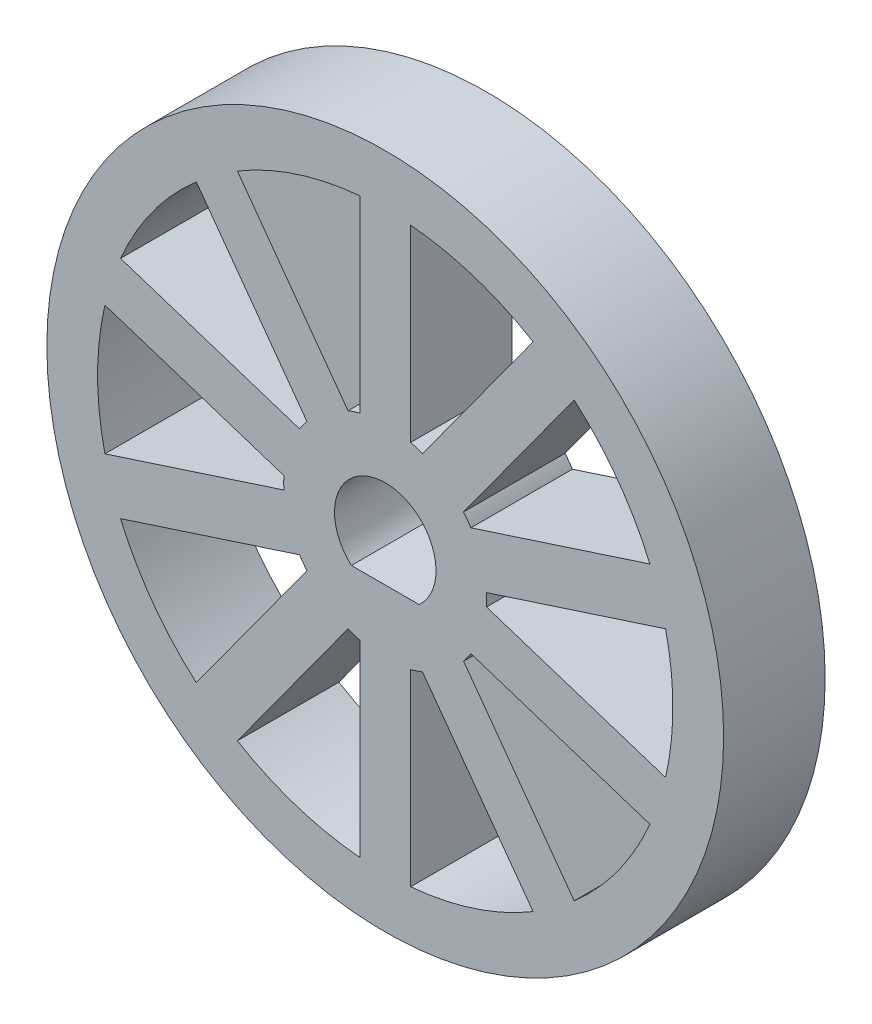
from build123d import *

# Parameters (mm, degrees)
SKETCH1_R           = 20
BOSS_EXTRUDE1_DEPTH = 6


with BuildPart() as part:
    # Sketch1 → Boss-Extrude1 (new body)
    with BuildSketch(Plane.XY):
        Circle(SKETCH1_R)
        with BuildLine():
            Line((-2, -2.236067977), (2, -2.236067977))
            ThreePointArc((2, -2.236067977), (0, 3), (-2, -2.236067977))
        make_face(mode=Mode.SUBTRACT)
        with BuildLine():
            Line((-16.568425726, -3.806214518), (-5.988664565, -0.368641735))
            ThreePointArc((-5.988664565, -0.368641735), (-6, 0), (-5.988664565, 0.368641735))
            Line((-5.988664565, 0.368641735), (-16.568425726, 3.806214518))
            ThreePointArc((-16.568425726, 3.806214518), (-17, 0), (-16.568425726, -3.806214518))
        make_face(mode=Mode.SUBTRACT)
        with BuildLine():
            Line((-1.5, -16.933694222), (-1.5, -5.809475019))
            ThreePointArc((-1.5, -5.809475019), (-1.854101966, -5.706339098), (-2.201198248, -5.581641897))
            Line((-2.201198248, -5.581641897), (-8.739850239, -14.581324281))
            ThreePointArc((-8.739850239, -14.581324281), (-5.253288904, -16.167960777), (-1.5, -16.933694222))
        make_face(mode=Mode.SUBTRACT)
        with BuildLine():
            Line((1.5, -16.933694222), (1.5, -5.809475019))
            ThreePointArc((1.5, -5.809475019), (1.854101966, -5.706339098), (2.201198248, -5.581641897))
            Line((2.201198248, -5.581641897), (8.739850239, -14.581324281))
            ThreePointArc((8.739850239, -14.581324281), (5.253288904, -16.167960777), (1.5, -16.933694222))
        make_face(mode=Mode.SUBTRACT)
        with BuildLine():
            Line((-1.5, 5.809475019), (-1.5, 16.933694222))
            ThreePointArc((-1.5, 16.933694222), (-5.253288904, 16.167960777), (-8.739850239, 14.581324281))
            Line((-8.739850239, 14.581324281), (-2.201198248, 5.581641897))
            ThreePointArc((-2.201198248, 5.581641897), (-1.854101966, 5.706339098), (-1.5, 5.809475019))
        make_face(mode=Mode.SUBTRACT)
        with BuildLine():
            Line((-5.061613582, 3.221811284), (-15.641374743, 6.659384067))
            ThreePointArc((-15.641374743, 6.659384067), (-13.753288904, 9.992349289), (-11.166901222, 12.817968525))
            Line((-11.166901222, 12.817968525), (-4.628249231, 3.818286141))
            ThreePointArc((-4.628249231, 3.818286141), (-4.854101966, 3.526711514), (-5.061613582, 3.221811284))
        make_face(mode=Mode.SUBTRACT)
        with BuildLine():
            Line((-15.641374743, -6.659384067), (-5.061613582, -3.221811284))
            ThreePointArc((-5.061613582, -3.221811284), (-4.854101966, -3.526711514), (-4.628249231, -3.818286141))
            Line((-4.628249231, -3.818286141), (-11.166901222, -12.817968525))
            ThreePointArc((-11.166901222, -12.817968525), (-13.753288904, -9.992349289), (-15.641374743, -6.659384067))
        make_face(mode=Mode.SUBTRACT)
        with BuildLine():
            Line((11.166901222, 12.817968525), (4.628249231, 3.818286141))
            ThreePointArc((4.628249231, 3.818286141), (4.854101966, 3.526711514), (5.061613582, 3.221811284))
            Line((5.061613582, 3.221811284), (15.641374743, 6.659384067))
            ThreePointArc((15.641374743, 6.659384067), (13.753288904, 9.992349289), (11.166901222, 12.817968525))
        make_face(mode=Mode.SUBTRACT)
        with BuildLine():
            Line((8.739850239, 14.581324281), (2.201198248, 5.581641897))
            ThreePointArc((2.201198248, 5.581641897), (1.854101966, 5.706339098), (1.5, 5.809475019))
            Line((1.5, 5.809475019), (1.5, 16.933694222))
            ThreePointArc((1.5, 16.933694222), (5.253288904, 16.167960777), (8.739850239, 14.581324281))
        make_face(mode=Mode.SUBTRACT)
        with BuildLine():
            Line((15.641374743, -6.659384067), (5.061613582, -3.221811284))
            ThreePointArc((5.061613582, -3.221811284), (4.854101966, -3.526711514), (4.628249231, -3.818286141))
            Line((4.628249231, -3.818286141), (11.166901222, -12.817968525))
            ThreePointArc((11.166901222, -12.817968525), (13.753288904, -9.992349289), (15.641374743, -6.659384067))
        make_face(mode=Mode.SUBTRACT)
        with BuildLine():
            Line((16.568425726, -3.806214518), (5.988664565, -0.368641735))
            ThreePointArc((5.988664565, -0.368641735), (6, 0), (5.988664565, 0.368641735))
            Line((5.988664565, 0.368641735), (16.568425726, 3.806214518))
            ThreePointArc((16.568425726, 3.806214518), (17, 0), (16.568425726, -3.806214518))
        make_face(mode=Mode.SUBTRACT)
    extrude(amount=BOSS_EXTRUDE1_DEPTH)


solid = part.part
